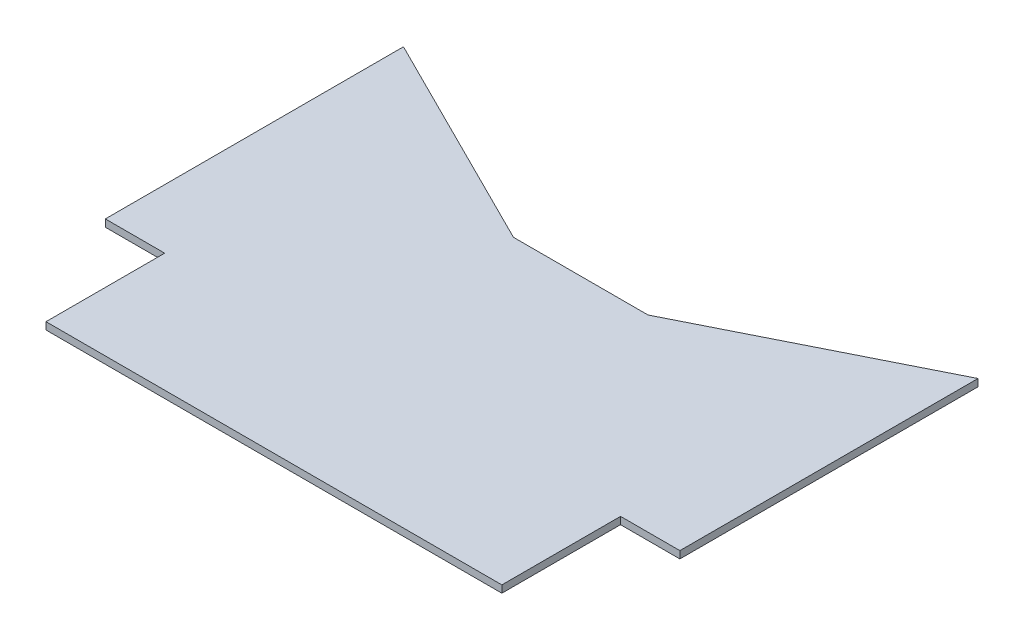
from build123d import *

# Parameters (mm, degrees)
BOSS_EXTRUDE1_DEPTH = 2.54


with BuildPart() as part:
    # Sketch1 → Boss-Extrude1 (new body)
    with BuildSketch(Plane(origin=(0, 0, 0), x_dir=(1, 0, 0), z_dir=(0, 1, 0))):
        Polygon((-80.01, 0), (80.01, 0), (80.01, 41.656), (100.838, 41.656), (100.838, 51.308), (100.838, 146.304), (23.622, 107.696), (-23.622, 107.696), (-100.838, 146.304), (-100.838, 51.308), (-100.838, 41.656), (-80.01, 41.656), align=None)
    extrude(amount=BOSS_EXTRUDE1_DEPTH)


solid = part.part
